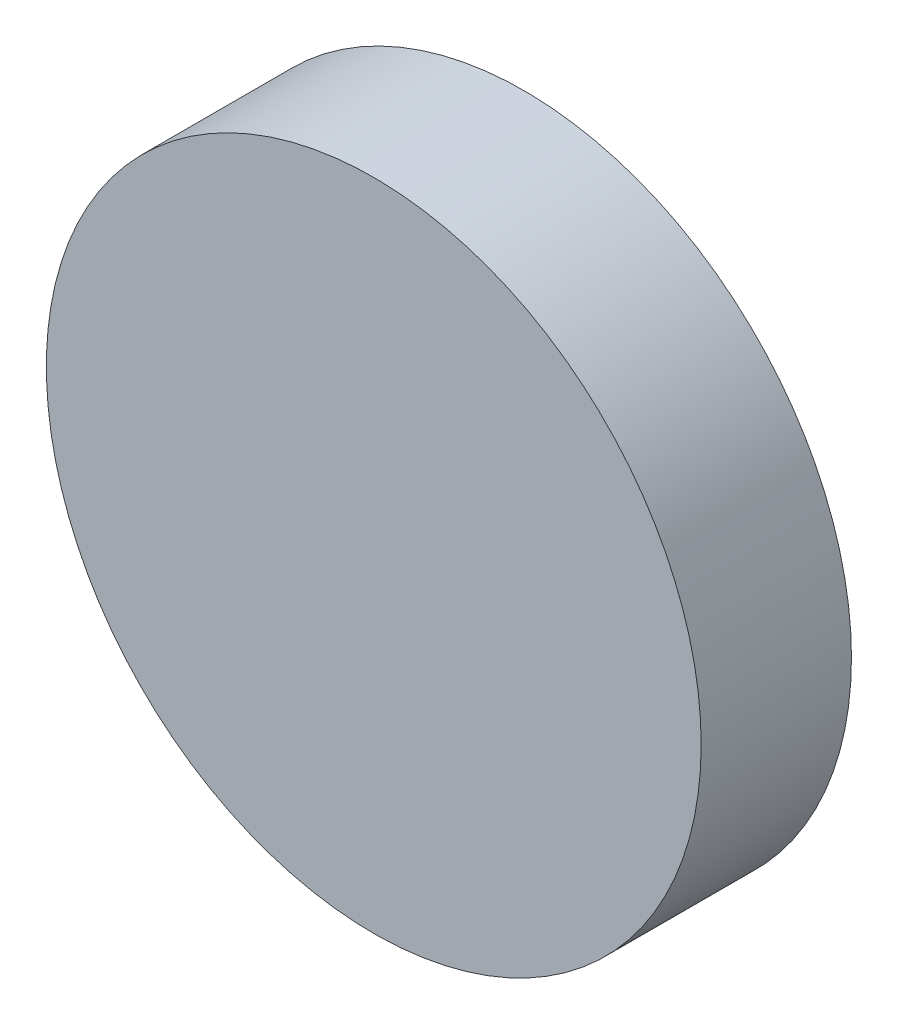
from build123d import *

# Parameters (mm, degrees)
SKETCH_1_R      = 15.25
EXTRUDE_1_DEPTH = 7


with BuildPart() as part:
    # ｽｹｯﾁ1 → ﾎﾞｽ - 押し出し1 (new body)
    with BuildSketch(Plane.XY):
        Circle(SKETCH_1_R)
    extrude(amount=EXTRUDE_1_DEPTH)


solid = part.part
